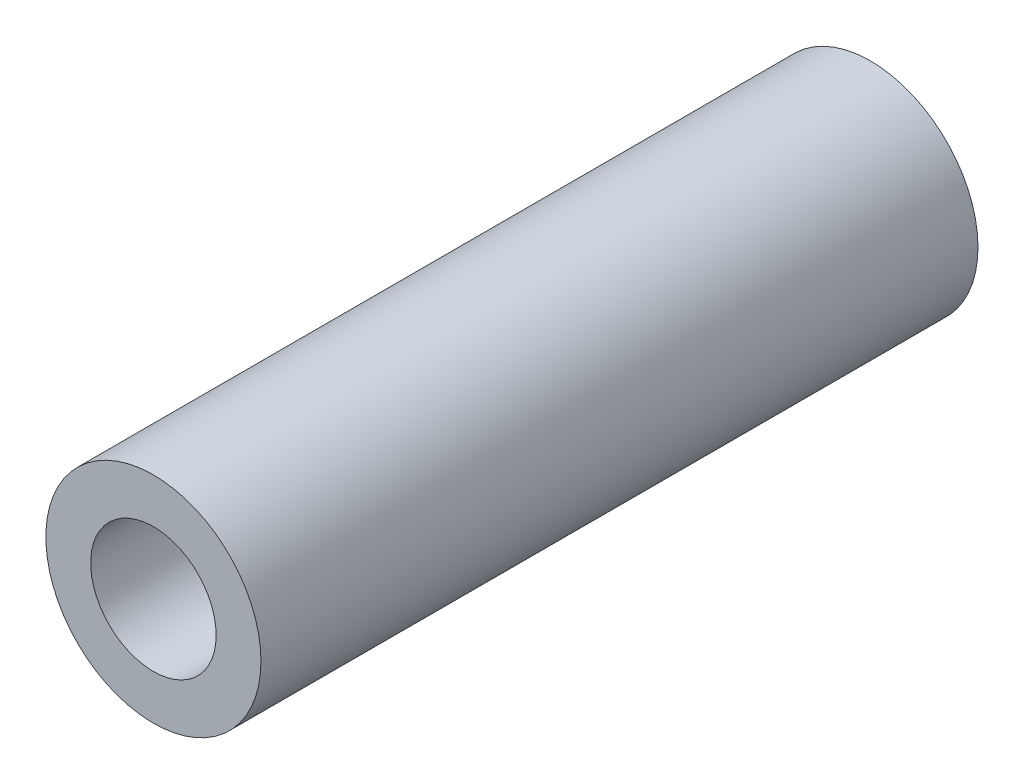
from build123d import *

# Parameters (mm, degrees)
SKETCH1_R           = 3
SKETCH1_R_2         = 1.75
BOSS_EXTRUDE1_DEPTH = 10


with BuildPart() as part:
    # Sketch1 → Boss-Extrude1 (new, symmetric)
    with BuildSketch(Plane.XY):
        Circle(SKETCH1_R)
        Circle(SKETCH1_R_2, mode=Mode.SUBTRACT)
    extrude(amount=BOSS_EXTRUDE1_DEPTH, both=True)


solid = part.part
